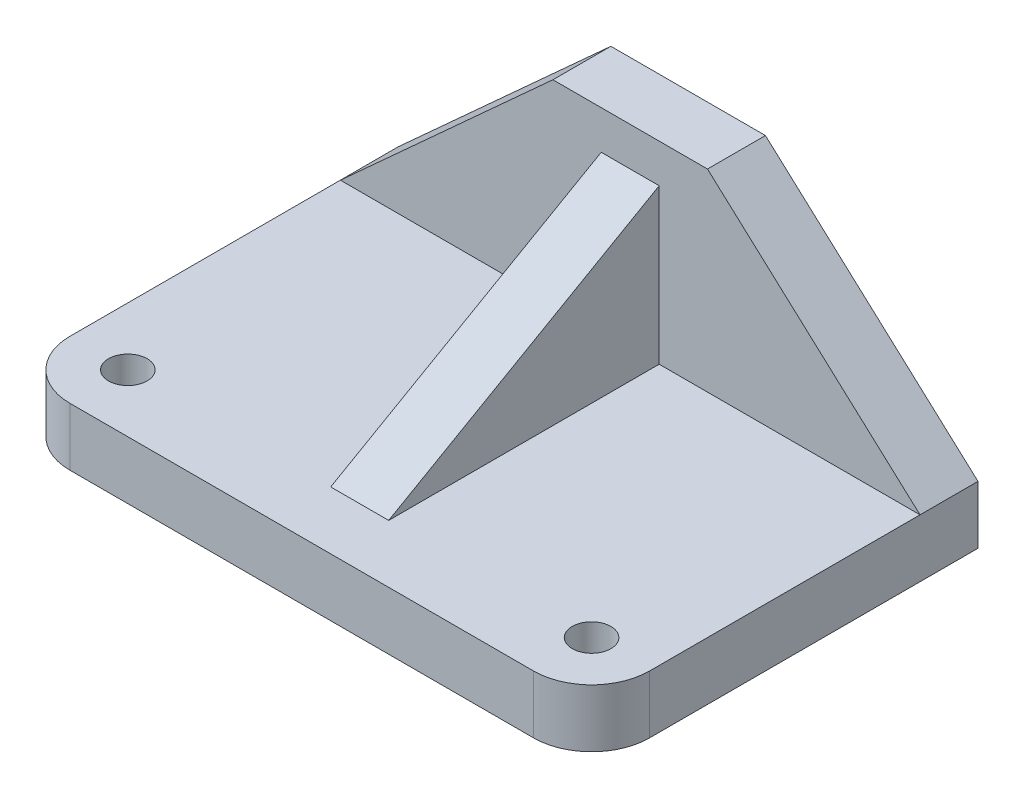
from build123d import *

# Parameters (mm, degrees)
SKETCH_3_W          = 299.999999948
SKETCH_3_H          = 200.00000005
EXTRUDE_1_DEPTH     = 30
FILLET_1_R          = 30
FILLET_2_R          = 30
EXTRUDE_2_DEPTH     = 30
SKETCH_4_R          = 10
CUT_EXTRUDE_1_DEPTH = 30
EXTRUDE_3_DEPTH     = 15


with BuildPart() as part:
    # 草图3 → 凸台-拉伸1 (new body)
    with BuildSketch(Plane(origin=(0, 0, 0), x_dir=(1, 0, 0), z_dir=(0, 1, 0))):
        Rectangle(SKETCH_3_W, SKETCH_3_H)
    extrude(amount=EXTRUDE_1_DEPTH)

    # 圆角1
    fillet_1_edges = [part.edges().sort_by_distance(p)[0] for p in [
        (-149.999999974, 15, 100.000000025),
    ]]
    fillet(fillet_1_edges, radius=FILLET_1_R)

    # 圆角2
    fillet_2_edges = [part.edges().sort_by_distance(p)[0] for p in [
        (149.999999974, 15, 100.000000025),
    ]]
    fillet(fillet_2_edges, radius=FILLET_2_R)

    # 草图5 → 凸台-拉伸2 (add)
    with BuildSketch(Plane(origin=(0, 0, -100.000000025), x_dir=(-1, 0, 0), z_dir=(0, 0, -1))):
        Polygon((-149.999999974, 30), (149.999999974, 30), (40, 130), (-40, 130), align=None)
    extrude(amount=-EXTRUDE_2_DEPTH)

    # 草图4 → 切除-拉伸1 (cut)
    with BuildSketch(Plane(origin=(0, 0, 0), x_dir=(1, 0, 0), z_dir=(0, 1, 0))):
        with Locations(Location((-119.999999974, -70.000000025, 0), (0, 0, 270))):
            Circle(SKETCH_4_R)
        with Locations(Location((119.999999974, -70.000000025, 0), (0, 0, 90))):
            Circle(SKETCH_4_R)
    extrude(amount=CUT_EXTRUDE_1_DEPTH, mode=Mode.SUBTRACT)

    # 草图7 → 凸台-拉伸3 (add, symmetric)
    with BuildSketch(Plane(origin=(0, 0, 0), x_dir=(0, 0, -1), z_dir=(1, 0, 0))):
        Polygon((-70.000000025, 30), (70.000000025, 110), (70.000000025, 30), align=None)
    extrude(amount=EXTRUDE_3_DEPTH, both=True)


solid = part.part
